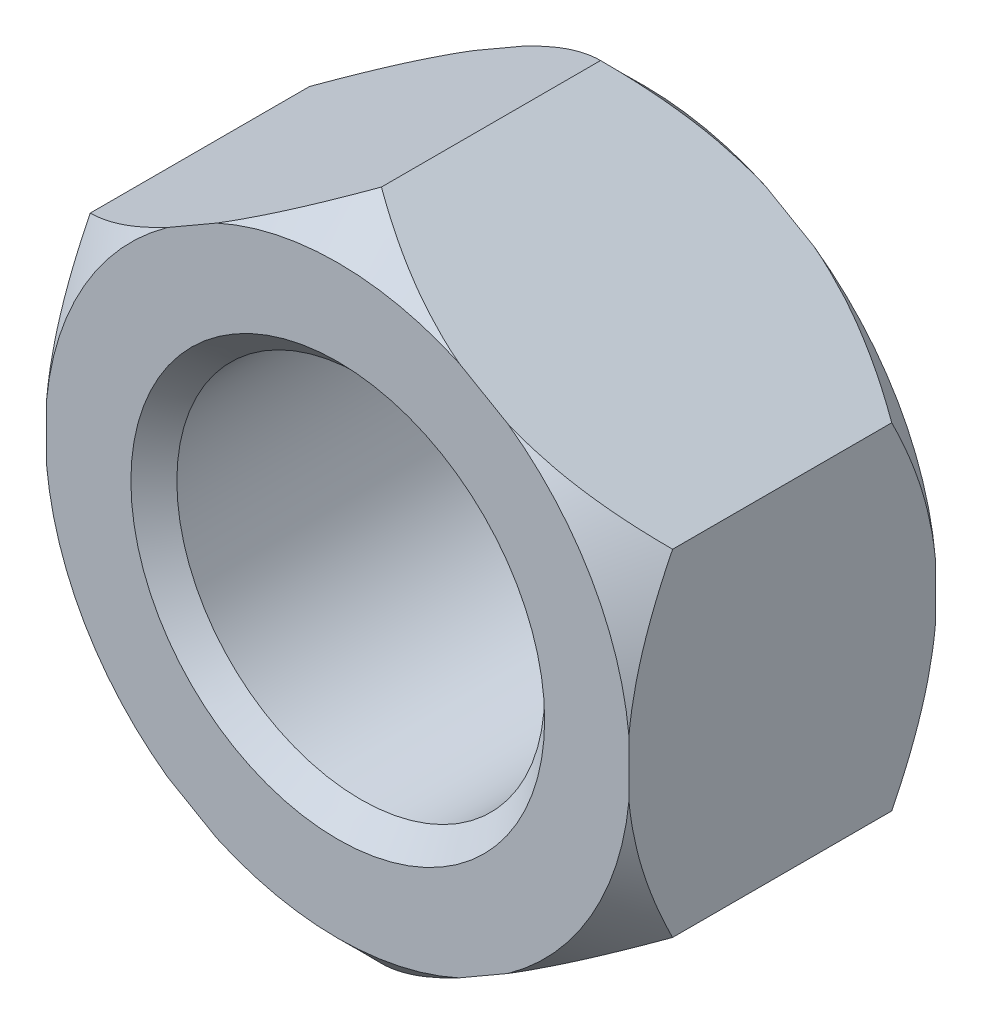
from build123d import *

# Parameters (mm, degrees)
EXTRUDE_1_DEPTH     = 10
SKETCH_2_R          = 6
CUT_EXTRUDE_1_DEPTH = 18.62337463
CHAMFER_1_SIZE      = 0.75


with BuildPart() as part:
    # Эскиз1 → Вытянуть1 (new body)
    with BuildSketch(Plane.XY):
        Polygon((0, 10.969655115), (-9.5, 5.484827557), (-9.5, -5.484827557), (0, -10.969655115), (9.5, -5.484827557), (9.5, 5.484827557), align=None)
    extrude(amount=EXTRUDE_1_DEPTH)

    # Эскиз15 → Вырез-Повернуть1 (revolve, cut)
    with BuildSketch(Plane(origin=(0, 0, 0), x_dir=(0, 0, -1), z_dir=(1, 0, 0))):
        Polygon((-10, 10.969655115), (-10, 9.544655115), (-8.575, 10.969655115), align=None)
        Polygon((-1.425, 10.969655115), (0, 10.969655115), (0, 9.544655115), align=None)
    revolve(axis=Axis((0, 0, 2.633835381), (0, 0, -1)), mode=Mode.SUBTRACT)

    # Эскиз2 → Вырез-Вытянуть1 (cut, through all)
    with BuildSketch(Plane(origin=(0, 0, 0), x_dir=(-1, 0, 0), z_dir=(0, 0, -1))):
        Circle(SKETCH_2_R)
    extrude(amount=-CUT_EXTRUDE_1_DEPTH, mode=Mode.SUBTRACT)

    # Фаска1
    chamfer_1_edges = [part.edges().sort_by_distance(p)[0] for p in [
        (6, 0, 10),
        (6, 0, 0),
    ]]
    chamfer(chamfer_1_edges, length=CHAMFER_1_SIZE)


solid = part.part
